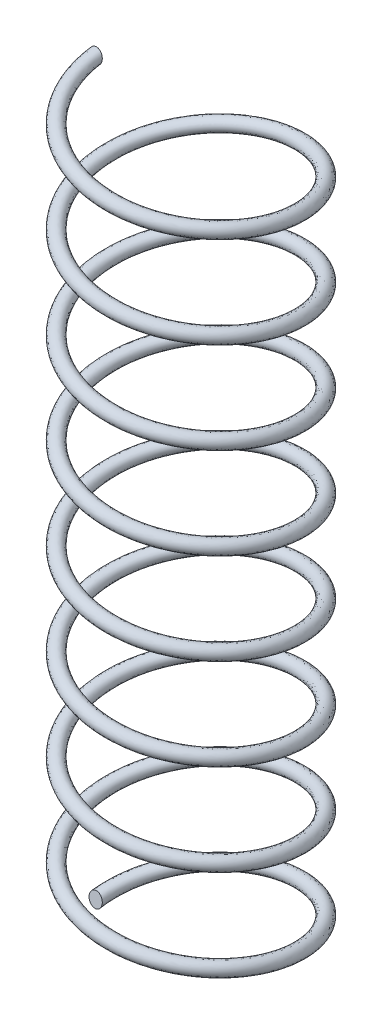
from build123d import *

# Parameters (mm, degrees)
SWEEP1_PITCH       = 3.286125
SWEEP1_HEIGHT      = 26.289
SWEEP1_RADIUS      = 3.429
SWEEP1_START_ANGLE = -90
SKETCH2_R          = 0.254


with BuildPart() as part:
    # Sweep1: sweep along a helix
    with BuildLine() as sweep1_path:
        add(Helix(SWEEP1_PITCH, SWEEP1_HEIGHT, SWEEP1_RADIUS, center=(0, 0, 0), direction=(0, 1, 0), lefthand=True, mode=Mode.PRIVATE).rotate(Axis((0, 0, 0), (0, 1, 0)), SWEEP1_START_ANGLE))
    # Sketch2 → Sweep1 (sweep)
    with BuildSketch(Plane(origin=(-3.429, 26.289, 0), x_dir=(-1, 0, 0), z_dir=(9.996178526552558e-14, 0.15077974436043495, -0.9885673819677655))):
        with Locations((-6.848303018, -1.701693347)):
            Circle(SKETCH2_R)
    sweep(path=sweep1_path.line, is_frenet=True)


solid = part.part
